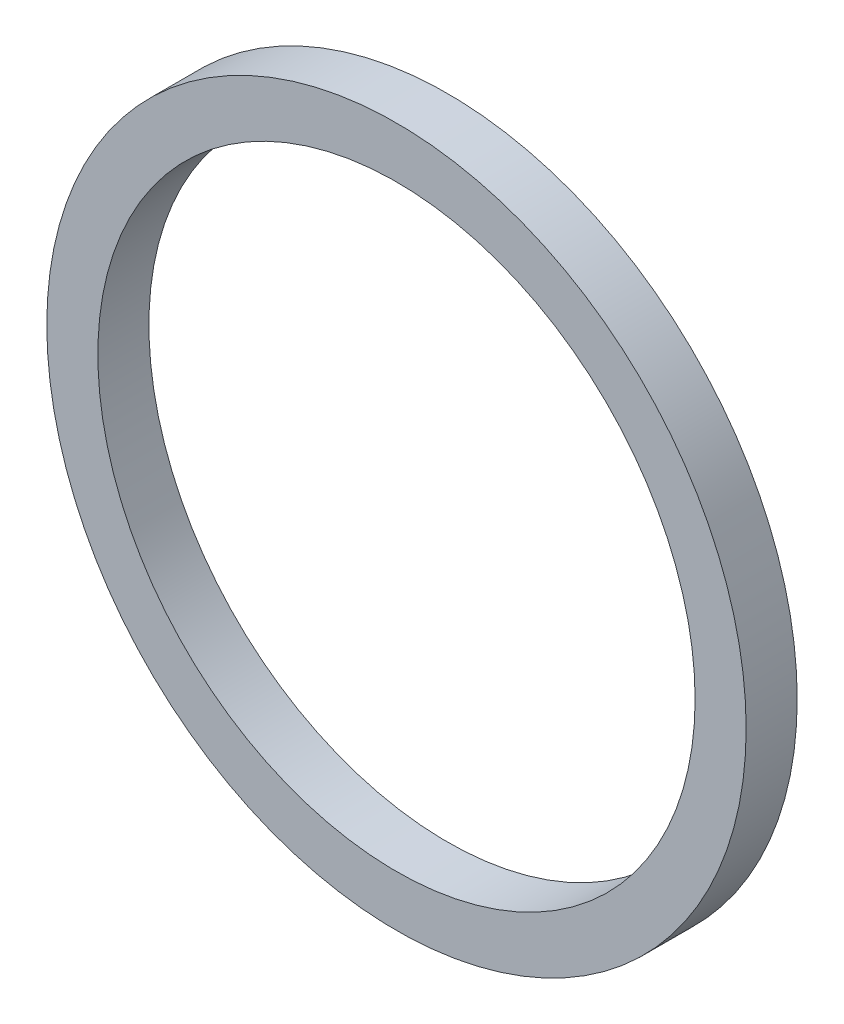
from build123d import *

# Parameters (mm, degrees)
ESQUISSE1_R          = 13.7
ESQUISSE1_R_2        = 11.7
BASE_EXTRUSION_DEPTH = 2


with BuildPart() as part:
    # Esquisse1 → Base-Extrusion (new body)
    with BuildSketch(Plane.XY):
        Circle(ESQUISSE1_R)
        Circle(ESQUISSE1_R_2, mode=Mode.SUBTRACT)
    extrude(amount=BASE_EXTRUSION_DEPTH)


solid = part.part
